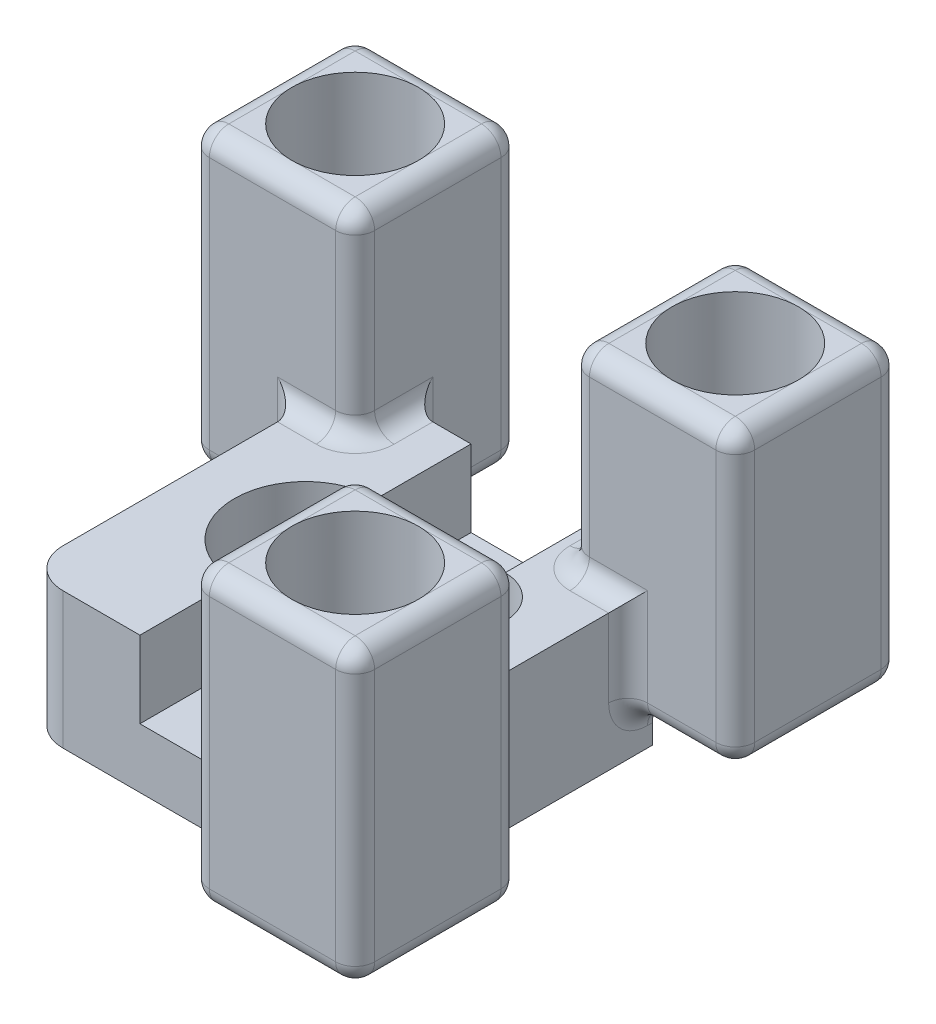
from build123d import *

# Parameters (mm, degrees)
SKETCH1_W                = 17
SKETCH1_H                = 17
BOSS_EXTRUDE1_DEPTH      = 7
CUT_EXTRUDE1_DEPTH       = 3.25
CUT_EXTRUDE2_DEPTH       = 3.94
BOSS_EXTRUDE2_START      = -5
SKETCH2_W                = 8.485281374
SKETCH2_H                = 8.485281374
BOSS_EXTRUDE2_DEPTH      = 15
SKETCH3_R                = 3.25
CUT_EXTRUDE3_DEPTH       = 25.821412127
FILLET1_R                = 1
CIRPATTERN3_COUNT        = 3
CIRPATTERN3_ANGLE        = 180
FILLET1_OF_CIRPATTERN3_R = 1
BOSS_EXTRUDE4_DEPTH      = 6
CUT_EXTRUDE6_DEPTH       = 28.548185231
SKETCH8_W                = 6.6
SKETCH8_H                = 3.94
CUT_EXTRUDE7_DEPTH       = 28.466798263
SKETCH9_R                = 0.625
CUT_EXTRUDE8_DEPTH       = 26.772584444
SKETCH9_3_R              = 0.95
SKETCH9_3_R_2            = 0.625
CUT_EXTRUDE9_DEPTH       = 2
SKETCH9_4_R              = 1
CUT_EXTRUDE10_DEPTH      = 0.5
FILLET5_R                = 2


with BuildPart() as part:
    # Sketch1 → Boss-Extrude1 (new body)
    with BuildSketch(Plane(origin=(0, 0, 0), x_dir=(1, 0, 0), z_dir=(0, 1, 0))):
        with Locations((2.55, 0)):
            Rectangle(SKETCH1_W, SKETCH1_H)
    extrude(amount=-BOSS_EXTRUDE1_DEPTH)

    # Sketch1<3> → Cut-Extrude1 (cut)
    with BuildSketch(Plane(origin=(0, 0, 0), x_dir=(1, 0, 0), z_dir=(0, 1, 0))):
        with BuildLine():
            Line((0, -3.65), (6.6, -3.65))
            ThreePointArc((6.6, -3.65), (8.12027958, -3.02027958), (8.75, -1.5))
            Line((8.75, -1.5), (8.75, 1.5))
            ThreePointArc((8.75, 1.5), (8.12027958, 3.02027958), (6.6, 3.65))
            Line((6.6, 3.65), (0, 3.65))
            ThreePointArc((0, 3.65), (-3.65, 0), (0, -3.65))
        make_face()
    extrude(amount=-CUT_EXTRUDE1_DEPTH, mode=Mode.SUBTRACT)

    # Sketch1<4> → Cut-Extrude2 (cut)
    with BuildSketch(Plane(origin=(0, 0, 0), x_dir=(1, 0, 0), z_dir=(0, 1, 0))):
        with BuildLine():
            Line((0, -3.65), (6.6, -3.65))
            ThreePointArc((6.6, -3.65), (8.12027958, -3.02027958), (8.75, -1.5))
            Line((8.75, -1.5), (8.75, 1.5))
            ThreePointArc((8.75, 1.5), (8.12027958, 3.02027958), (6.6, 3.65))
            Line((6.6, 3.65), (0, 3.65))
            ThreePointArc((0, 3.65), (-3.65, 0), (0, -3.65))
        make_face()
    extrude(amount=-CUT_EXTRUDE2_DEPTH, mode=Mode.SUBTRACT)

    # Sketch2 → Boss-Extrude2 (add)
    with BuildSketch(Plane(origin=(0, 0, 0), x_dir=(1, 0, 0), z_dir=(0, 1, 0)).offset(BOSS_EXTRUDE2_START)):
        with Locations((-7.207359313, 9.757359313)):
            Rectangle(SKETCH2_W, SKETCH2_H)
    boss_extrude2 = extrude(amount=BOSS_EXTRUDE2_DEPTH)

    # Sketch3 → Cut-Extrude3 (cut, symmetric)
    with BuildSketch(Plane(origin=(0, 10, 0), x_dir=(1, 0, 0), z_dir=(0, 1, 0))):
        with Locations((-7.207359313, 9.757359313)):
            Circle(SKETCH3_R)
    cut_extrude3 = extrude(amount=CUT_EXTRUDE3_DEPTH, both=True, mode=Mode.SUBTRACT)

    # Fillet1
    fillet1_edges = [part.edges().sort_by_distance(p)[0] for p in [
        (-3.587577462, -5, -8.5),
        (-5.95, -5, -6.137577462),
        (-2.964718626, 10, -9.757359313),
        (-2.964718626, -5, -11.25),
        (-2.964718626, -2.5, -8.5),
        (-2.964718626, 0, -7.007359313),
        (-7.207359313, -5, -14),
        (-2.964718626, 2.5, -14),
        (-7.207359313, 10, -14),
        (-11.45, -5, -9.757359313),
        (-11.45, 2.5, -14),
        (-11.45, 10, -9.757359313),
        (-5.95, -2.5, -5.514718626),
        (-8.7, -5, -5.514718626),
        (-11.45, 2.5, -5.514718626),
        (-7.207359313, 10, -5.514718626),
        (-2.964718626, 5, -5.514718626),
        (-4.457359313, 0, -5.514718626),
    ]]
    fillet(fillet1_edges, radius=FILLET1_R)

    # CirPattern3: Boss-Extrude2, Cut-Extrude3 ×3 about axis
    cirpattern3_axis = Axis((2.55, 0, 0), (0, -1, 0))
    add([boss_extrude2.rotate(cirpattern3_axis, i * CIRPATTERN3_ANGLE / (CIRPATTERN3_COUNT - 1)) for i in range(1, CIRPATTERN3_COUNT)])
    add([cut_extrude3.rotate(cirpattern3_axis, i * CIRPATTERN3_ANGLE / (CIRPATTERN3_COUNT - 1)) for i in range(1, CIRPATTERN3_COUNT)], mode=Mode.SUBTRACT)

    # Fillet1 of CirPattern3
    fillet1_of_cirpattern3_edges = [part.edges().sort_by_distance(p)[0] for p in [
        (11.05, -5, -6.137577462),
        (8.687577462, -5, -8.5),
        (12.307359313, 10, -5.514718626),
        (13.8, -5, -5.514718626),
        (11.05, -2.5, -5.514718626),
        (9.557359313, 0, -5.514718626),
        (16.55, -5, -9.757359313),
        (16.55, 2.5, -5.514718626),
        (16.55, 10, -9.757359313),
        (12.307359313, -5, -14),
        (16.55, 2.5, -14),
        (12.307359313, 10, -14),
        (8.064718626, -2.5, -8.5),
        (8.064718626, -5, -11.25),
        (8.064718626, 2.5, -14),
        (8.064718626, 10, -9.757359313),
        (8.064718626, 5, -5.514718626),
        (8.064718626, 0, -7.007359313),
        (8.687577462, -5, 8.5),
        (11.05, -5, 6.137577462),
        (8.064718626, 10, 9.757359313),
        (8.064718626, -5, 11.25),
        (8.064718626, -2.5, 8.5),
        (8.064718626, 0, 7.007359313),
        (12.307359313, -5, 14),
        (8.064718626, 2.5, 14),
        (12.307359313, 10, 14),
        (16.55, -5, 9.757359313),
        (16.55, 2.5, 14),
        (16.55, 10, 9.757359313),
        (11.05, -2.5, 5.514718626),
        (13.8, -5, 5.514718626),
        (16.55, 2.5, 5.514718626),
        (12.307359313, 10, 5.514718626),
        (8.064718626, 5, 5.514718626),
        (9.557359313, 0, 5.514718626),
    ]]
    fillet(fillet1_of_cirpattern3_edges, radius=FILLET1_OF_CIRPATTERN3_R)

    # Sketch6 → Boss-Extrude4 (add)
    with BuildSketch(Plane(origin=(0, -7, 0), x_dir=(1, 0, 0), z_dir=(0, 1, 0))):
        with BuildLine():
            Line((0, 2.5), (5, 2.5))
            Line((5, 2.5), (5, -2.5))
            Line((5, -2.5), (0, -2.5))
            ThreePointArc((0, -2.5), (-2.5, 0), (0, 2.5))
        make_face()
        with BuildLine():
            Line((4.5, 2), (4.5, -2))
            Line((4.5, -2), (0, -2))
            ThreePointArc((0, -2), (-2, 0), (0, 2))
            Line((0, 2), (4.5, 2))
        make_face(mode=Mode.SUBTRACT)
    extrude(amount=-BOSS_EXTRUDE4_DEPTH)

    # Sketch6<3> → Cut-Extrude6 (cut, through all)
    with BuildSketch(Plane(origin=(0, -7, 0), x_dir=(1, 0, 0), z_dir=(0, 1, 0))):
        with BuildLine():
            Line((4.5, 2), (4.5, -2))
            Line((4.5, -2), (0, -2))
            ThreePointArc((0, -2), (-2, 0), (0, 2))
            Line((0, 2), (4.5, 2))
        make_face()
    extrude(amount=CUT_EXTRUDE6_DEPTH, mode=Mode.SUBTRACT)

    # Sketch8 → Cut-Extrude7 (cut, through all)
    with BuildSketch(Plane.XY.offset(-3.65)):
        with Locations((3.3, -1.97)):
            Rectangle(SKETCH8_W, SKETCH8_H)
    cut_extrude7 = extrude(amount=-CUT_EXTRUDE7_DEPTH, mode=Mode.SUBTRACT)

    # Mirror1: Cut-Extrude7 across plane
    add(cut_extrude7.mirror(Plane.XY), mode=Mode.SUBTRACT)

    # Sketch9 → Cut-Extrude8 (cut, through all)
    with BuildSketch(Plane(origin=(0, -3.94, 0), x_dir=(1, 0, 0), z_dir=(0, 1, 0))):
        with Locations((3.8, 5.175)):
            Circle(SKETCH9_R)
        with Locations((3.8, -5.175)):
            Circle(SKETCH9_R)
    extrude(amount=-CUT_EXTRUDE8_DEPTH, mode=Mode.SUBTRACT)

    # Sketch9<3> → Cut-Extrude9 (cut)
    # profile 1 of 2: a face of its own
    with BuildSketch(Plane(origin=(0, -3.94, 0), x_dir=(1, 0, 0), z_dir=(0, 1, 0))):
        with Locations((3.8, 5.175)):
            Circle(SKETCH9_3_R)
    # profile 2 of 2: a face of its own
    with BuildSketch(Plane(origin=(0, -3.94, 0), x_dir=(1, 0, 0), z_dir=(0, 1, 0))):
        with Locations((3.8, -5.175)):
            Circle(SKETCH9_3_R)
        with Locations((3.8, -5.175)):
            Circle(SKETCH9_3_R_2, mode=Mode.SUBTRACT)
    extrude(amount=-CUT_EXTRUDE9_DEPTH, mode=Mode.SUBTRACT)

    # Sketch9<4> → Cut-Extrude10 (cut)
    with BuildSketch(Plane(origin=(0, -3.94, 0), x_dir=(1, 0, 0), z_dir=(0, 1, 0))):
        with Locations((3.8, 5.175)):
            Circle(SKETCH9_4_R)
        with Locations((3.8, -5.175)):
            Circle(SKETCH9_4_R)
    extrude(amount=-CUT_EXTRUDE10_DEPTH, mode=Mode.SUBTRACT)

    # Fillet5
    fillet5_edges = [part.edges().sort_by_distance(p)[0] for p in [
        (-5.95, -3.5, 8.5),
    ]]
    fillet(fillet5_edges, radius=FILLET5_R)


solid = part.part
